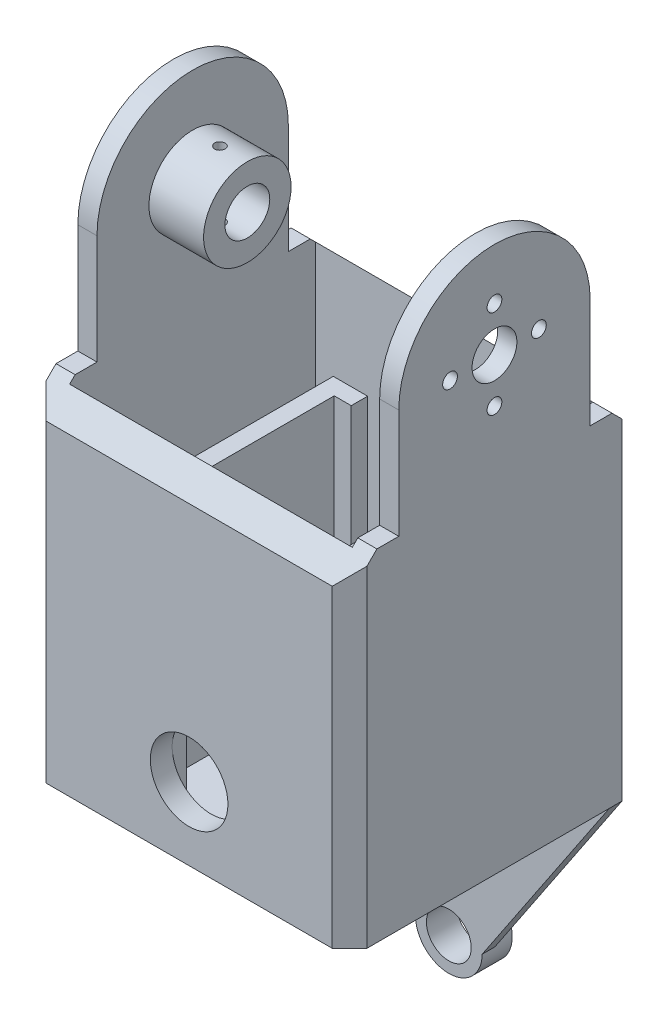
from build123d import *

# Parameters (mm, degrees)
SKETCH1_R                = 4.1
BOSS_EXTRUDE1_DEPTH      = 3.5
BOSS_EXTRUDE2_DEPTH      = 51.7
BOSS_EXTRUDE2_DEPTH_BACK = 3.5
CHAMFER2_SIZE            = 5
CUT_EXTRUDE1_REACH       = 112.079
SKETCH4_W                = 51.7
SKETCH4_H                = 45
BOSS_EXTRUDE3_START      = 3.5
SKETCH5_R                = 4.1
BOSS_EXTRUDE3_DEPTH      = 3.5
CUT_EXTRUDE3_REACH       = 104.062
SKETCH9_R                = 1.35
SKETCH10_W               = 58.7
SKETCH10_H               = 53
BOSS_EXTRUDE5_DEPTH      = 3.175
SKETCH26_R               = 7.1
CUT_EXTRUDE6_DEPTH       = 4
SKETCH27_W               = 3.175
SKETCH27_H               = 34.600130378
BOSS_EXTRUDE6_DEPTH      = 45.22
SKETCH29_R               = 4.1
BOSS_EXTRUDE8_DEPTH      = 5.5
CHAMFER3_SIZE            = 3.175
BOSS_EXTRUDE9_START      = 10
SKETCH30_R               = 8
SKETCH30_R_2             = 4.1
BOSS_EXTRUDE9_DEPTH      = 10
SKETCH31_R               = 0.95
CUT_EXTRUDE7_DEPTH       = 120.972242206
BOSS_EXTRUDE10_DEPTH     = 45.22
SKETCH33_W               = 5.386290257
SKETCH33_H               = 2.7
BOSS_EXTRUDE11_DEPTH     = 45.22
BOSS_EXTRUDE12_DEPTH     = 0.2


with BuildPart() as part:
    # Sketch1 → Boss-Extrude1 (new body)
    with BuildSketch(Plane(origin=(0, 0, 0), x_dir=(0, 0, -1), z_dir=(1, 0, 0))):
        with BuildLine():
            Line((-17.5, 0), (-17.5, -20))
            Line((-17.5, -20), (-22.5, -20))
            Line((-22.5, -20), (-22.5, -76))
            Line((-22.5, -76), (22.5, -76))
            Line((22.5, -76), (22.5, -20))
            Line((22.5, -20), (17.5, -20))
            Line((17.5, -20), (17.5, 0))
            ThreePointArc((17.5, 0), (0, 17.5), (-17.5, 0))
        make_face()
        Circle(SKETCH1_R, mode=Mode.SUBTRACT)
    extrude(amount=-BOSS_EXTRUDE1_DEPTH)

    # Sketch2 → Boss-Extrude2 (add, two sides: drawn at the far end of the back side and taken through both)
    with BuildSketch(Plane(origin=(0, 0, 0), x_dir=(0, 0, -1), z_dir=(1, 0, 0)).offset(-BOSS_EXTRUDE2_DEPTH_BACK)):
        Polygon((-22.5, -20), (-22.5, -76), (22.5, -76), (22.5, -20), (26.5, -20), (26.5, -79.175), (-26.5, -79.175), (-26.5, -20), align=None)
    extrude(amount=BOSS_EXTRUDE2_DEPTH + BOSS_EXTRUDE2_DEPTH_BACK)

    # Chamfer2
    chamfer2_edges = [part.edges().sort_by_distance(p)[0] for p in [
        (24.1, -20, -26.5),
        (24.1, -20, 26.5),
    ]]
    chamfer(chamfer2_edges, length=CHAMFER2_SIZE)

    # Sketch4 → Cut-Extrude1 (cut, up to next)
    with BuildSketch(Plane(origin=(0, -76, 0), x_dir=(1, 0, 0), z_dir=(0, 1, 0)), mode=Mode.PRIVATE) as cut_extrude1_sk1:
        with Locations((25.85, 0)):
            Rectangle(SKETCH4_W, SKETCH4_H)
    cut_extrude1_tool1 = extrude(cut_extrude1_sk1.sketch, amount=-CUT_EXTRUDE1_REACH, mode=Mode.PRIVATE) & part.part
    add(cut_extrude1_tool1.solids().sort_by_distance((25.85, -76, 0))[0], mode=Mode.SUBTRACT)

    # Sketch5 → Boss-Extrude3 (add)
    with BuildSketch(Plane(origin=(51.7, 0, 0), x_dir=(0, 0, -1), z_dir=(1, 0, 0)).offset(BOSS_EXTRUDE3_START)):
        with BuildLine():
            Line((21.5, -20), (17.5, -20))
            Line((17.5, -20), (17.5, 0))
            ThreePointArc((17.5, 0), (0, 17.5), (-17.5, 0))
            Line((-17.5, 0), (-17.5, -20))
            Line((-17.5, -20), (-21.5, -20))
            Line((-21.5, -20), (-26.5, -25))
            Line((-26.5, -25), (-26.5, -79.175))
            Line((-26.5, -79.175), (26.5, -79.175))
            Line((26.5, -79.175), (26.5, -25))
            Line((26.5, -25), (21.5, -20))
        make_face()
        Circle(SKETCH5_R, mode=Mode.SUBTRACT)
    extrude(amount=-BOSS_EXTRUDE3_DEPTH)

    # Sketch9 → Cut-Extrude3 (cut, up to next)
    with BuildSketch(Plane(origin=(55.2, 0, 0), x_dir=(0, 0, -1), z_dir=(1, 0, 0)), mode=Mode.PRIVATE) as cut_extrude3_sk1:
        with Locations((0, 8.125)):
            Circle(SKETCH9_R)
    cut_extrude3_tool1 = extrude(cut_extrude3_sk1.sketch, amount=-CUT_EXTRUDE3_REACH, mode=Mode.PRIVATE) & part.part
    # Sketch9 → Cut-Extrude3 (cut, up to next)
    with BuildSketch(Plane(origin=(55.2, 0, 0), x_dir=(0, 0, -1), z_dir=(1, 0, 0)), mode=Mode.PRIVATE) as cut_extrude3_sk2:
        with Locations((8.125, 0)):
            Circle(SKETCH9_R)
    cut_extrude3_tool2 = extrude(cut_extrude3_sk2.sketch, amount=-CUT_EXTRUDE3_REACH, mode=Mode.PRIVATE) & part.part
    # Sketch9 → Cut-Extrude3 (cut, up to next)
    with BuildSketch(Plane(origin=(55.2, 0, 0), x_dir=(0, 0, -1), z_dir=(1, 0, 0)), mode=Mode.PRIVATE) as cut_extrude3_sk3:
        with Locations((0, -8.125)):
            Circle(SKETCH9_R)
    cut_extrude3_tool3 = extrude(cut_extrude3_sk3.sketch, amount=-CUT_EXTRUDE3_REACH, mode=Mode.PRIVATE) & part.part
    # Sketch9 → Cut-Extrude3 (cut, up to next)
    with BuildSketch(Plane(origin=(55.2, 0, 0), x_dir=(0, 0, -1), z_dir=(1, 0, 0)), mode=Mode.PRIVATE) as cut_extrude3_sk4:
        with Locations((-8.125, 0)):
            Circle(SKETCH9_R)
    cut_extrude3_tool4 = extrude(cut_extrude3_sk4.sketch, amount=-CUT_EXTRUDE3_REACH, mode=Mode.PRIVATE) & part.part
    add(cut_extrude3_tool1.solids().sort_by_distance((55.2, 8.125, 0))[0], mode=Mode.SUBTRACT)
    add(cut_extrude3_tool2.solids().sort_by_distance((55.2, 0, -8.125))[0], mode=Mode.SUBTRACT)
    add(cut_extrude3_tool3.solids().sort_by_distance((55.2, -8.125, 0))[0], mode=Mode.SUBTRACT)
    add(cut_extrude3_tool4.solids().sort_by_distance((55.2, 0, 8.125))[0], mode=Mode.SUBTRACT)

    # Sketch10 → Boss-Extrude5 (add)
    with BuildSketch(Plane.XZ.offset(79.175)):
        with Locations((25.85, 0)):
            Rectangle(SKETCH10_W, SKETCH10_H)
    extrude(amount=BOSS_EXTRUDE5_DEPTH)

    # Sketch26 → Cut-Extrude6 (cut)
    with BuildSketch(Plane.XY.offset(26.5)):
        with Locations((25.85, -69.065)):
            Circle(SKETCH26_R)
    extrude(amount=-CUT_EXTRUDE6_DEPTH, mode=Mode.SUBTRACT)

    # Sketch27 → Boss-Extrude6 (add)
    with BuildSketch(Plane(origin=(0, -79.175, 0), x_dir=(1, 0, 0), z_dir=(0, 1, 0))):
        with Locations((39.993724488, -5.199934811)):
            Rectangle(SKETCH27_W, SKETCH27_H)
        with Locations((11.706275512, -5.199934811)):
            Rectangle(SKETCH27_W, SKETCH27_H)
    extrude(amount=BOSS_EXTRUDE6_DEPTH)

    # Sketch29 → Boss-Extrude8 (add)
    with BuildSketch(Plane(origin=(0, 0, -26.5), x_dir=(-1, 0, 0), z_dir=(0, 0, -1))):
        with BuildLine():
            Line((-40.997321429, -82.35), (-55.2, -82.35))
            Line((-55.2, -82.35), (-31.95, -117.07))
            ThreePointArc((-31.95, -117.07), (-25.85, -123.17), (-19.75, -117.07))
            Line((-19.75, -117.07), (3.5, -82.35))
            Line((3.5, -82.35), (-10.702678571, -82.35))
            Line((-10.702678571, -82.35), (-10.702678571, -88.35))
            Line((-10.702678571, -88.35), (-20.85, -103.503333333))
            Line((-20.85, -103.503333333), (-30.85, -103.503333333))
            Line((-30.85, -103.503333333), (-40.997321429, -88.35))
            Line((-40.997321429, -88.35), (-40.997321429, -82.35))
        make_face()
        with Locations(Location((-25.85, -117.07, 0), (0, 0, 90))):
            Circle(SKETCH29_R, mode=Mode.SUBTRACT)
    extrude(amount=-BOSS_EXTRUDE8_DEPTH)

    # Chamfer3
    chamfer3_edges = [part.edges().sort_by_distance(p)[0] for p in [
        (43.575, -99.71, -26.5),
        (8.125, -99.71, -26.5),
        (-3.5, -53.675, -26.5),
        (-3.5, -53.675, 26.5),
        (55.2, -53.675, 26.5),
        (55.2, -53.675, -26.5),
    ]]
    chamfer(chamfer3_edges, length=CHAMFER3_SIZE)

    # Sketch30 → Boss-Extrude9 (add)
    with BuildSketch(Plane(origin=(0, 0, 0), x_dir=(0, 0, -1), z_dir=(1, 0, 0)).offset(BOSS_EXTRUDE9_START)):
        Circle(SKETCH30_R)
        Circle(SKETCH30_R_2, mode=Mode.SUBTRACT)
    extrude(amount=-BOSS_EXTRUDE9_DEPTH)

    # Sketch31 → Cut-Extrude7 (cut, through all)
    with BuildSketch(Plane(origin=(0, -20, 0), x_dir=(1, 0, 0), z_dir=(0, 1, 0))):
        with Locations(Location((5, 0, 0), (0, 0, 90))):
            Circle(SKETCH31_R)
    extrude(amount=CUT_EXTRUDE7_DEPTH, mode=Mode.SUBTRACT)

    # Sketch32 → Boss-Extrude10 (add)
    with BuildSketch(Plane(origin=(0, -79.175, 0), x_dir=(1, 0, 0), z_dir=(0, 1, 0))):
        Polygon((13.293775512, 12.600036526), (16.4, 12.600036526), (16.4, 15.600130378), (10.118775512, 15.600130378), (10.118775512, 12.100130378), (13.293775512, 12.100130378), align=None)
    boss_extrude10 = extrude(amount=BOSS_EXTRUDE10_DEPTH)

    # Sketch33 → Boss-Extrude11 (add)
    with BuildSketch(Plane(origin=(0, -79.175, 0), x_dir=(1, 0, 0), z_dir=(0, 1, 0))):
        with Locations((15.986920641, -21.15)):
            Rectangle(SKETCH33_W, SKETCH33_H)
    boss_extrude11 = extrude(amount=BOSS_EXTRUDE11_DEPTH)

    # Mirror1: Boss-Extrude10, Boss-Extrude11 across plane
    add(boss_extrude10.mirror(Plane.ZY.offset(-25.85)))
    add(boss_extrude11.mirror(Plane.ZY.offset(-25.85)))

    # Sketch34 → Boss-Extrude12 (add)
    with BuildSketch(Plane(origin=(0, -33.955, 0), x_dir=(1, 0, 0), z_dir=(0, 1, 0))):
        Polygon((13.293775512, -19.8), (13.293775512, 12.600036526), (16.4, 12.600036526), (16.4, 15.600130378), (10.118775512, 15.600130378), (10.118775512, -22.5), (18.680065769, -22.5), (18.680065769, -19.8), align=None)
        Polygon((41.581224488, -22.5), (41.581224488, 15.600130378), (35.3, 15.600130378), (35.3, 12.600036526), (38.406224488, 12.600036526), (38.406224488, -19.8), (33.019934231, -19.8), (33.019934231, -22.5), align=None)
    extrude(amount=BOSS_EXTRUDE12_DEPTH)


solid = part.part
